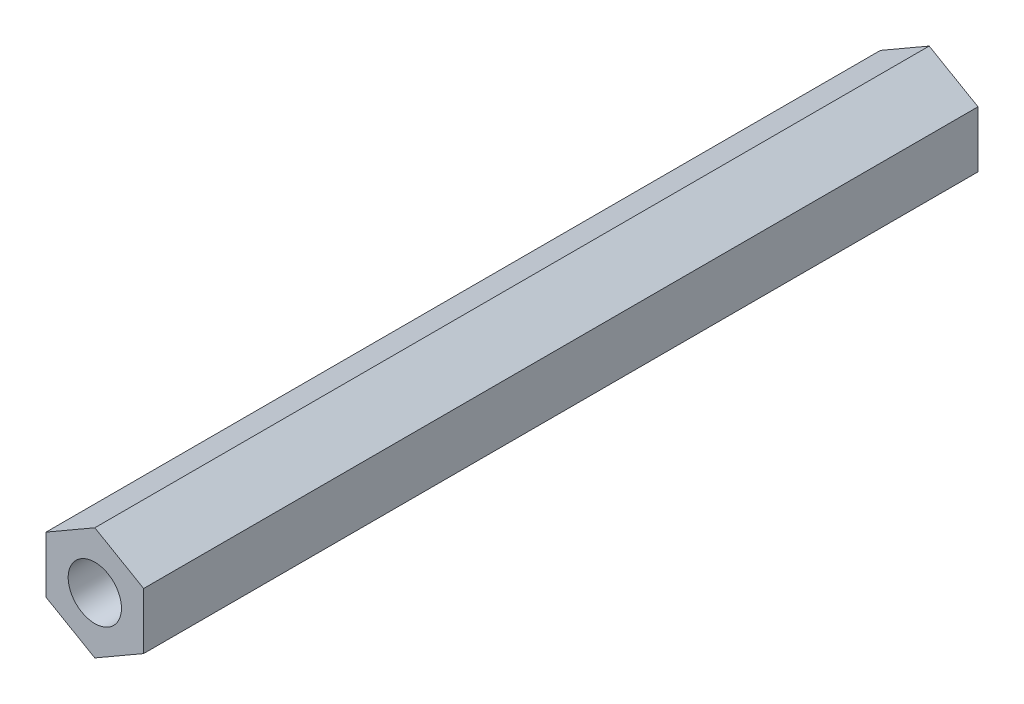
from build123d import *

# Parameters (mm, degrees)
ESQUISSE1_R        = 1.5
BOSS_EXTRU_1_DEPTH = 47


with BuildPart() as part:
    # Esquisse1 → Boss.-Extru.1 (new body)
    with BuildSketch(Plane.XY):
        Polygon((0, -3.175426481), (2.75, -1.58771324), (2.75, 1.58771324), (0, 3.175426481), (-2.75, 1.58771324), (-2.75, -1.58771324), align=None)
        Circle(ESQUISSE1_R, mode=Mode.SUBTRACT)
    extrude(amount=BOSS_EXTRU_1_DEPTH)


solid = part.part
